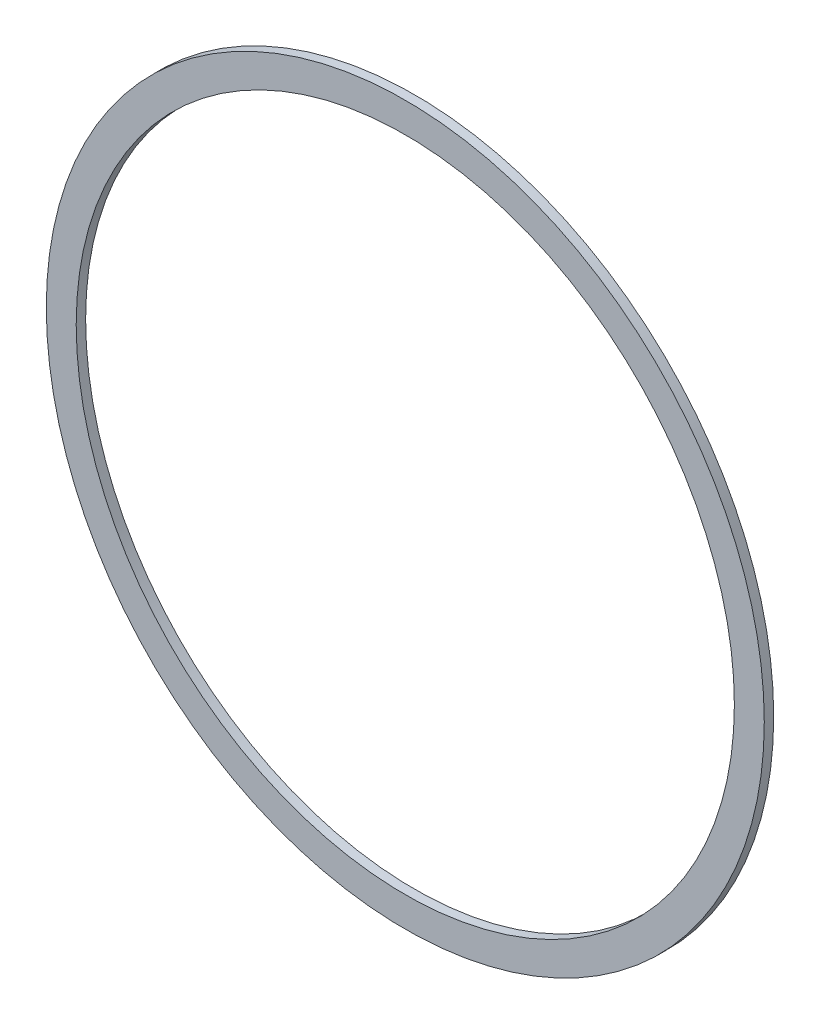
from build123d import *

# Parameters (mm, degrees)
SKETCH1_R           = 76.2
SKETCH1_R_2         = 69.85
BOSS_EXTRUDE1_DEPTH = 1


with BuildPart() as part:
    # Sketch1 → Boss-Extrude1 (new, symmetric)
    with BuildSketch(Plane.XY):
        Circle(SKETCH1_R)
        Circle(SKETCH1_R_2, mode=Mode.SUBTRACT)
    extrude(amount=BOSS_EXTRUDE1_DEPTH, both=True)


solid = part.part
